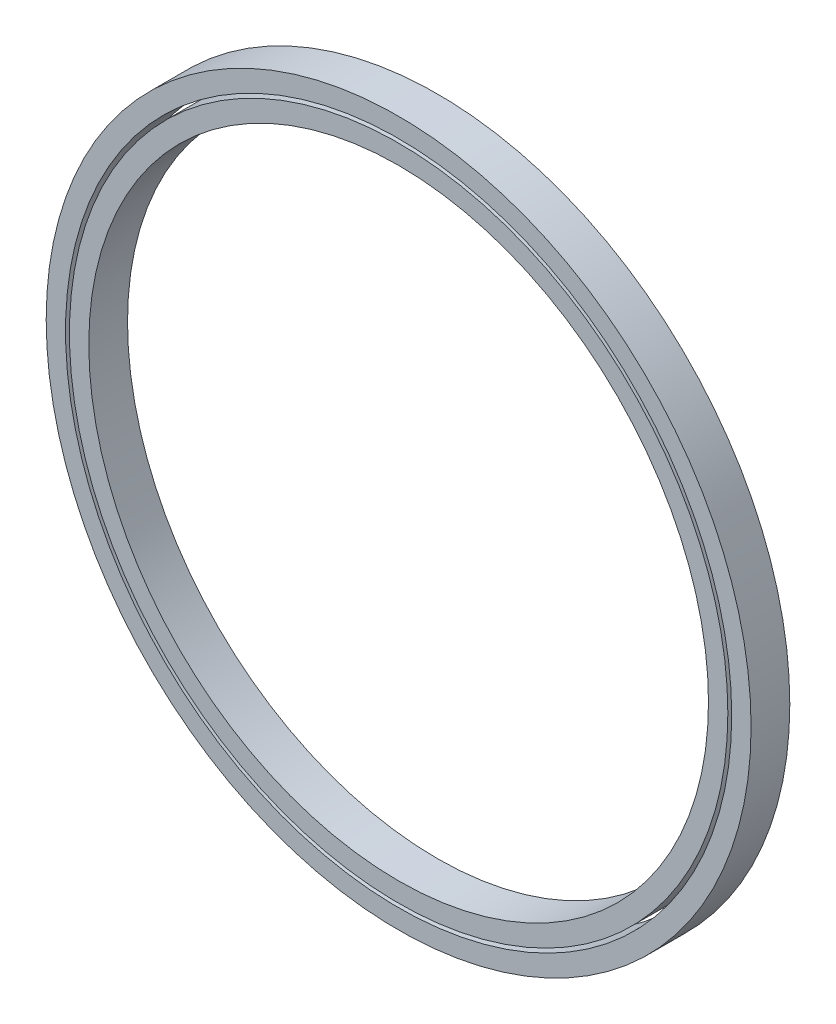
from build123d import *

# Parameters (mm, degrees)
SKETCH1_R             = 42.5
SKETCH1_R_2           = 40
BOSS_EXTRUDE1_DEPTH   = 2.5
SKETCH1_R_3           = 45.5
SKETCH1_R_4           = 43
BOSS_EXTRUDE1_2_DEPTH = 2.5


with BuildPart() as part:
    # Sketch1 → Boss-Extrude1 (new, symmetric)
    with BuildSketch(Plane.XY):
        Circle(SKETCH1_R)
        Circle(SKETCH1_R_2, mode=Mode.SUBTRACT)
    extrude(amount=BOSS_EXTRUDE1_DEPTH, both=True)


with BuildPart() as body_2:
    # Sketch1 → Boss-Extrude1 2 (new, symmetric)
    with BuildSketch(Plane.XY):
        Circle(SKETCH1_R_3)
        Circle(SKETCH1_R_4, mode=Mode.SUBTRACT)
    extrude(amount=BOSS_EXTRUDE1_2_DEPTH, both=True)


solid = Compound([part.part, body_2.part])
